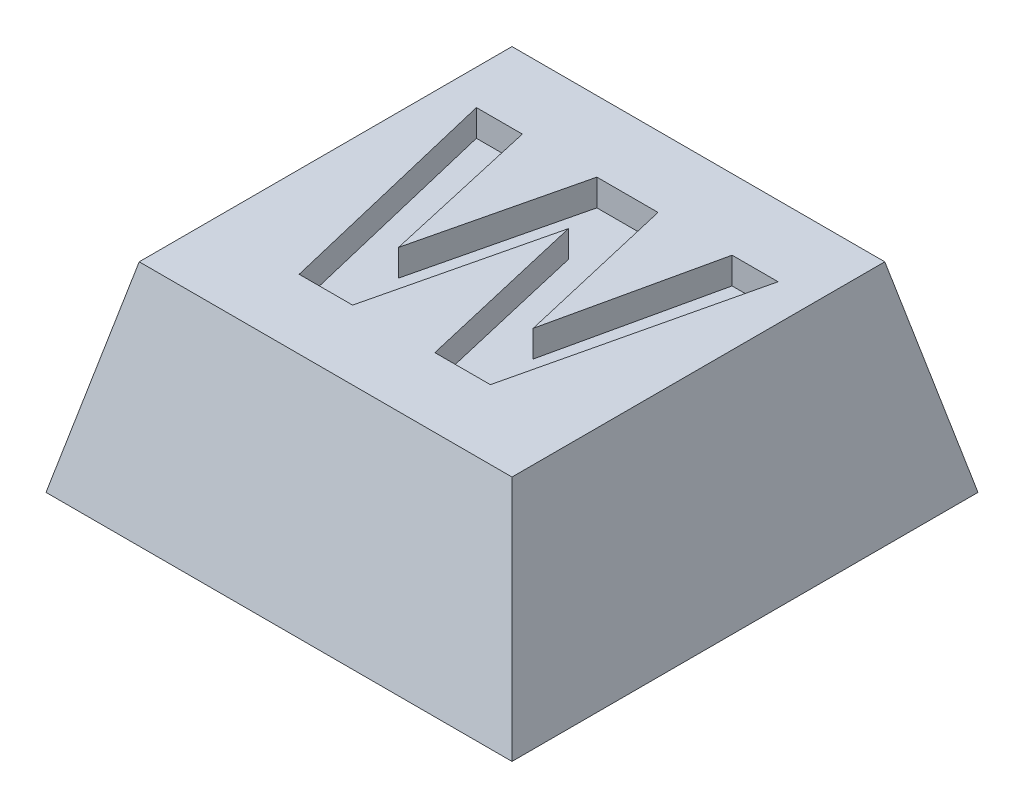
from build123d import *

# Parameters (mm, degrees)
SKETCH1_W           = 7
SKETCH1_H           = 7
BOSS_EXTRUDE1_DEPTH = 3
CUT_EXTRUDE1_DEPTH  = 7
CUT_EXTRUDE2_DEPTH  = 11
SKETCH4_R           = 1.8
CUT_EXTRUDE3_DEPTH  = 0.8
CUT_EXTRUDE4_DEPTH  = 0.4


with BuildPart() as part:
    # Sketch1 → Boss-Extrude1 (new body)
    with BuildSketch(Plane(origin=(0, 0, 0), x_dir=(1, 0, 0), z_dir=(0, 1, 0))):
        with Locations((3.5, 3.5)):
            Rectangle(SKETCH1_W, SKETCH1_H)
    extrude(amount=BOSS_EXTRUDE1_DEPTH)

    # Sketch2 → Cut-Extrude1 (cut)
    with BuildSketch(Plane.XY):
        Polygon((0, 0), (0.7, 3), (0, 3), align=None)
        Polygon((7, 0), (6.3, 3), (7, 3), align=None)
    extrude(amount=-CUT_EXTRUDE1_DEPTH, mode=Mode.SUBTRACT)

    # Sketch3 → Cut-Extrude2 (cut)
    with BuildSketch(Plane(origin=(0, 0, 0), x_dir=(0, 0, -1), z_dir=(1, 0, 0))):
        Polygon((0, 0), (0.7, 3), (0, 3), align=None)
        Polygon((7, 3), (6.3, 3), (7, 0), align=None)
    extrude(amount=CUT_EXTRUDE2_DEPTH, mode=Mode.SUBTRACT)

    # Sketch4 → Cut-Extrude3 (cut)
    with BuildSketch(Plane.XZ):
        with Locations(Location((3.5, -3.5, 0), (0, 0, 270))):
            Circle(SKETCH4_R)
    extrude(amount=-CUT_EXTRUDE3_DEPTH, mode=Mode.SUBTRACT)

    # Sketch5 → Cut-Extrude4 (cut)
    with BuildSketch(Plane(origin=(0, 3, 0), x_dir=(1, 0, 0), z_dir=(0, 1, 0))):
        Polygon((2.064112454, 1.739041449), (1.226271909, 5.239041449), (1.916175755, 5.239041449), (2.460246268, 2.834894814), (3.035867261, 5.239041449), (3.954336813, 5.239041449), (4.524348832, 2.79422975), (5.067017101, 5.239041449), (5.758323191, 5.239041449), (4.935907325, 1.739041449), (4.102273511, 1.739041449), (3.49229755, 4.355627987), (2.866195787, 1.739041449), align=None)
    extrude(amount=-CUT_EXTRUDE4_DEPTH, mode=Mode.SUBTRACT)


solid = part.part
